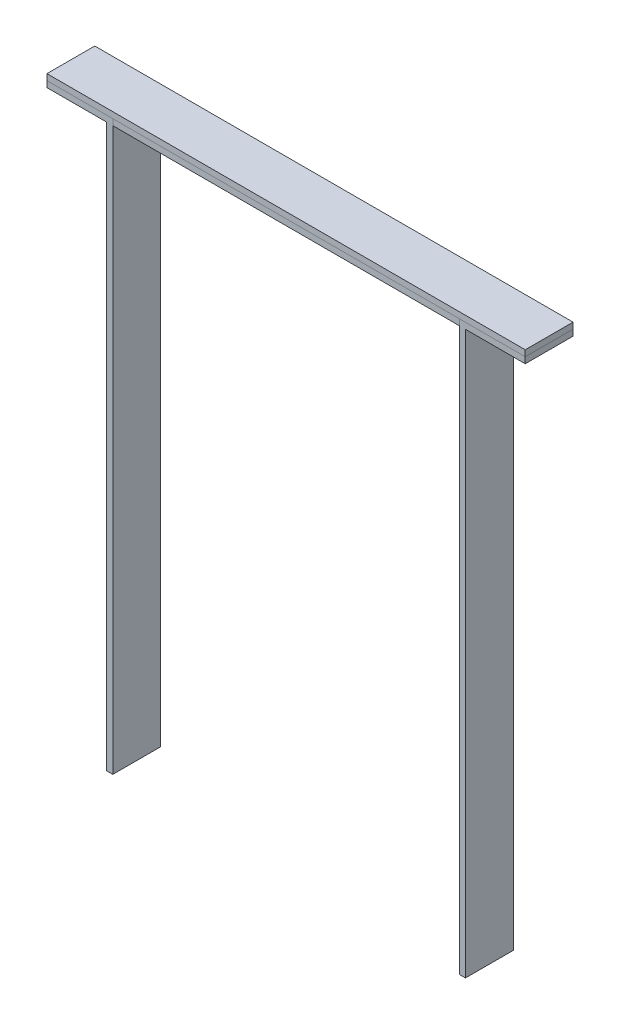
from build123d import *

# Parameters (mm, degrees)
BOSS_EXTRUDE1_DEPTH   = 10
BOSS_EXTRUDE1_2_DEPTH = 10
SKETCH2_4_W           = 72.46
SKETCH2_4_H           = 1.27
BOSS_EXTRUDE2_DEPTH   = 10
BOSS_EXTRUDE3_DEPTH   = 10


with BuildPart() as part:
    # Sketch2 → Boss-Extrude1 (new body)
    with BuildSketch(Plane.XY):
        Polygon((0, 117.46), (0, 0), (1.27, 0), (1.27, 118.73), (-12.5, 118.73), (-12.5, 117.46), align=None)
    extrude(amount=BOSS_EXTRUDE1_DEPTH)


with BuildPart() as body_2:
    # Sketch2 → Boss-Extrude1 2 (new body)
    with BuildSketch(Plane.XY):
        Polygon((73.73, 118.73), (73.73, 0), (75, 0), (75, 117.46), (87.5, 117.46), (87.5, 118.73), align=None)
    extrude(amount=BOSS_EXTRUDE1_2_DEPTH)


with BuildPart() as body_3:
    # Sketch2<4> → Boss-Extrude2 (new body)
    with BuildSketch(Plane.XY):
        with Locations((37.5, 118.095)):
            Rectangle(SKETCH2_4_W, SKETCH2_4_H)
    extrude(amount=BOSS_EXTRUDE2_DEPTH)


with BuildPart() as body_4:
    # Sketch2<5> → Boss-Extrude3 (new body)
    with BuildSketch(Plane.XY):
        Polygon((-12.5, 120), (-12.5, 118.73), (1.27, 118.73), (73.73, 118.73), (87.5, 118.73), (87.5, 120), align=None)
    extrude(amount=BOSS_EXTRUDE3_DEPTH)


solid = Compound([part.part, body_2.part, body_3.part, body_4.part])
